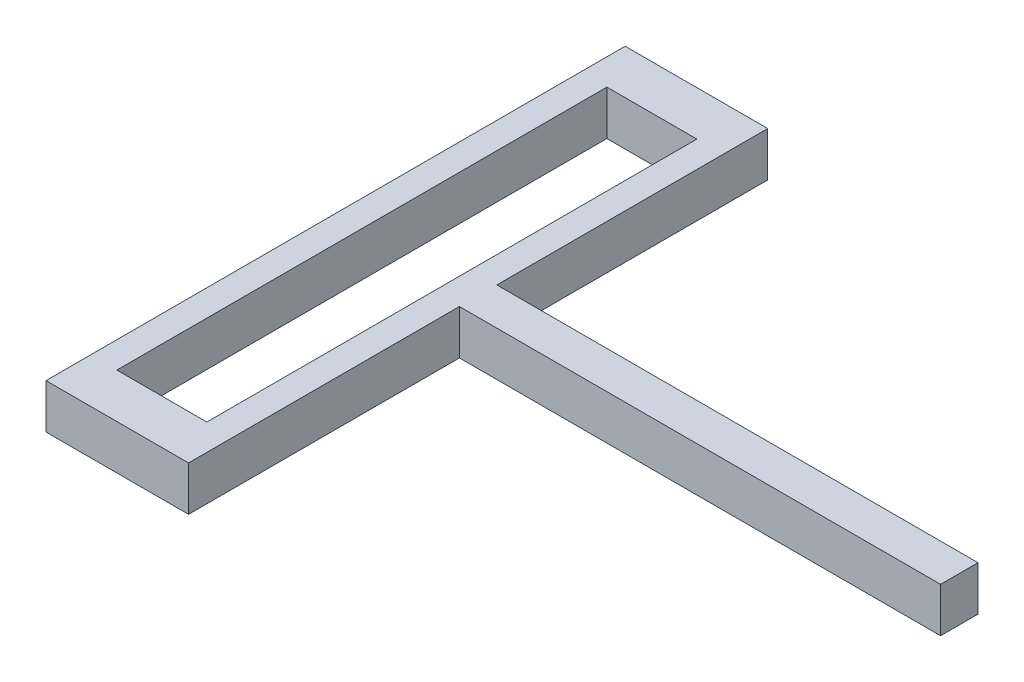
from build123d import *

# Parameters (mm, degrees)
EXTRUDE_1_DEPTH = 5


with BuildPart() as part:
    # 草圖1 → 填料-伸長1 (new body)
    with BuildSketch(Plane(origin=(0, 0, 0), x_dir=(1, 0, 0), z_dir=(0, 1, 0))):
        Polygon((-29.65648855, 0), (-29.65648855, 32.5), (-13.65648855, 32.5), (-13.65648855, 2.1), (40.34351145, 2.1), (40.34351145, 0), (-16.60648855, 0), (-16.60648855, 27.5), (-26.70648855, 27.5), (-26.70648855, 0), align=None)
    extrude_1 = extrude(amount=EXTRUDE_1_DEPTH)

    # 鏡射1: 填料-伸長1 across plane
    add(extrude_1.mirror(Plane(origin=(-16.60648855, 5, 0), x_dir=(1, 0, 0), z_dir=(0, 0, -1))))


solid = part.part
